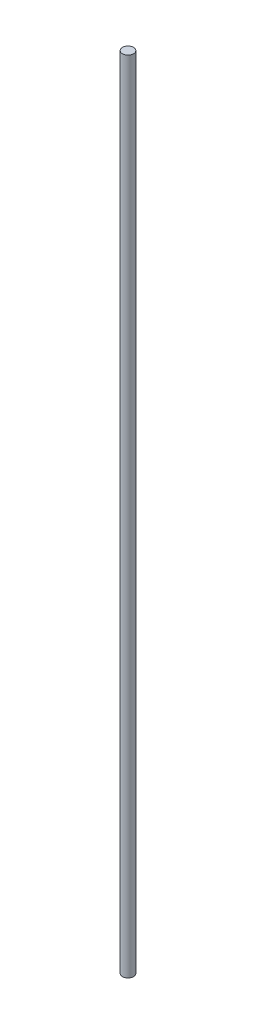
from build123d import *

# Parameters (mm, degrees)
SKETCH1_R           = 3.175
BOSS_EXTRUDE1_DEPTH = 457.2


with BuildPart() as part:
    # Sketch1 → Boss-Extrude1 (new body)
    with BuildSketch(Plane(origin=(0, 0, 0), x_dir=(1, 0, 0), z_dir=(0, 1, 0))):
        with Locations(Location((0, 0, 0), (0, 0, 270))):
            Circle(SKETCH1_R)
    extrude(amount=BOSS_EXTRUDE1_DEPTH)


solid = part.part
